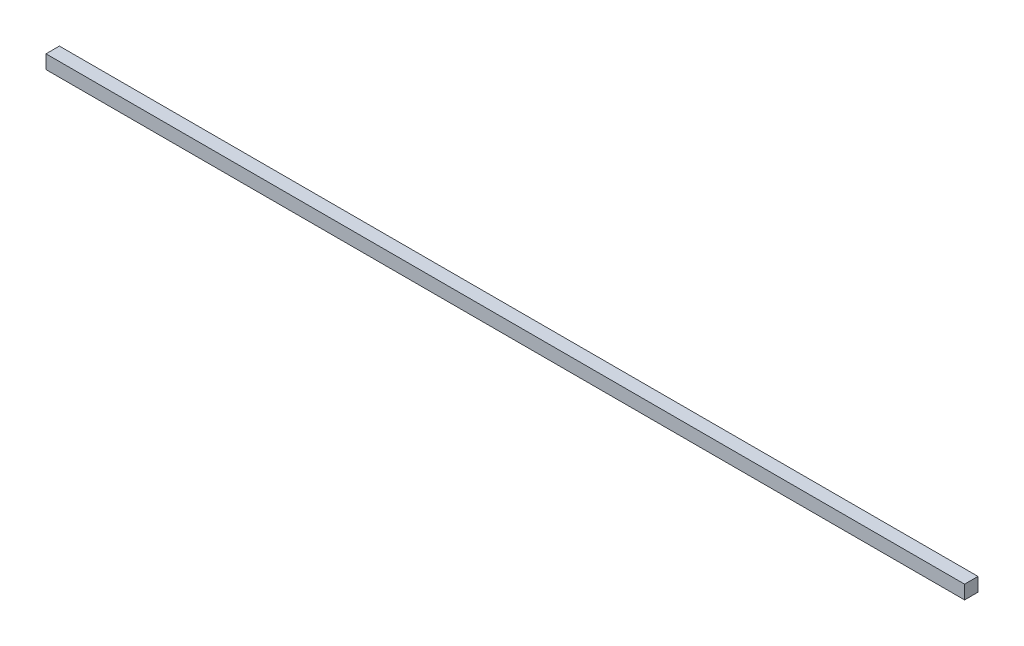
from build123d import *

# Parameters (mm, degrees)
MODEL_W         = 342.366650955
MODEL_H         = 5.1
EXTRUDE_1_DEPTH = 5


with BuildPart() as part:
    # Model → 凸台-拉伸1 (new body)
    with BuildSketch(Plane.XY):
        with Locations((750.686747378, 59.554962924)):
            Rectangle(MODEL_W, MODEL_H)
    extrude(amount=EXTRUDE_1_DEPTH)


solid = part.part
